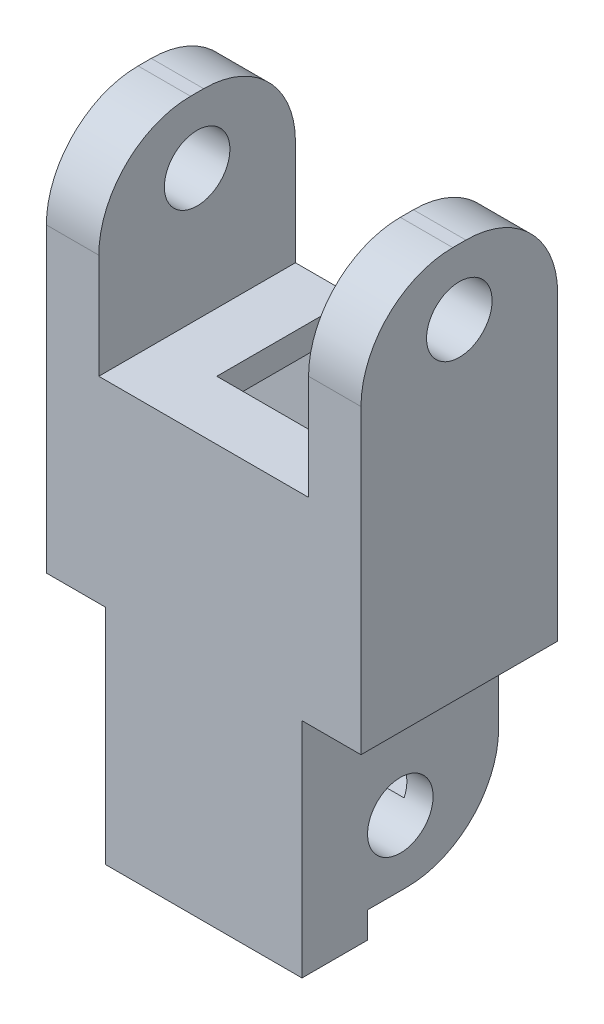
from build123d import *

# Parameters (mm, degrees)
SKETCH1_W           = 20
SKETCH1_H           = 11
SKETCH1_W_2         = 11
SKETCH1_H_2         = 13
BOSS_EXTRUDE1_DEPTH = 15
SKETCH2_R           = 2.5
CUT_EXTRUDE1_DEPTH  = 36
CUT_EXTRUDE2_DEPTH  = 36
CUT_EXTRUDE3_START  = 2
SKETCH1_3_W         = 20
SKETCH1_3_H         = 11
SKETCH1_3_W_2       = 11
SKETCH1_3_H_2       = 13
CUT_EXTRUDE3_DEPTH  = 11
FILLET4_R           = 7
BOSS_EXTRUDE2_REACH = 40.798
SKETCH5_W           = 5
SKETCH5_H           = 2


with BuildPart() as part:
    # Sketch1 → Boss-Extrude1 (new body)
    # profile 1 of 3: a face of its own
    with BuildSketch(Plane.XY):
        Polygon((-12, -15), (-12, 15), (-8, 15), (-8, 0), (8, 0), (8, 15), (12, 15), (12, -15), (7.5, -15), (7.5, -30), (-7.5, -30), (-7.5, -15), align=None)
        with Locations((0, -7.5)):
            Rectangle(SKETCH1_W, SKETCH1_H, mode=Mode.SUBTRACT)
    # profile 2 of 3: a face of its own
    with BuildSketch(Plane.XY):
        with Locations((0, -7.5)):
            Rectangle(SKETCH1_W, SKETCH1_H)
    # profile 3 of 3: a face of its own
    with BuildSketch(Plane.XY):
        with Locations((0, -19.5)):
            Rectangle(SKETCH1_W_2, SKETCH1_H_2)
    extrude(amount=BOSS_EXTRUDE1_DEPTH)

    # Sketch2 → Cut-Extrude1 (cut)
    with BuildSketch(Plane(origin=(12, 0, 0), x_dir=(0, 0, -1), z_dir=(1, 0, 0))):
        with Locations(Location((-7.5, 10, 0), (0, 0, 90))):
            Circle(SKETCH2_R)
        with Locations(Location((-7.5, -25, 0), (0, 0, 180))):
            Circle(SKETCH2_R)
    extrude(amount=-CUT_EXTRUDE1_DEPTH, mode=Mode.SUBTRACT)

    # Sketch3 → Cut-Extrude2 (cut)
    with BuildSketch(Plane(origin=(0, 0, 0), x_dir=(1, 0, 0), z_dir=(0, 1, 0))):
        Polygon((-1.25, 0), (1.25, 0), (1.25, -1.5), (3.5, -1.5), (3.5, -10.5), (-3.5, -10.5), (-3.5, -1.5), (-1.25, -1.5), align=None)
    extrude(amount=-CUT_EXTRUDE2_DEPTH, mode=Mode.SUBTRACT)

    # Sketch1<3> → Cut-Extrude3 (cut)
    with BuildSketch(Plane.XY.offset(CUT_EXTRUDE3_START)):
        with Locations((0, -7.5)):
            Rectangle(SKETCH1_3_W, SKETCH1_3_H)
        with Locations((0, -19.5)):
            Rectangle(SKETCH1_3_W_2, SKETCH1_3_H_2)
    extrude(amount=CUT_EXTRUDE3_DEPTH, mode=Mode.SUBTRACT)

    # Fillet4
    fillet4_edges = [part.edges().sort_by_distance(p)[0] for p in [
        (10, 15, 15),
        (10, 15, 0),
        (-10, 15, 15),
        (-10, 15, 0),
        (4.375, -30, 0),
        (-4.375, -30, 0),
    ]]
    fillet(fillet4_edges, radius=FILLET4_R)

    # Boss-Extrude2: up to this face of the body (flat: up to its plane)
    boss_extrude2_end = Plane(part.part.faces().sort_by_distance((-7.5, -21.9277031, 7.820372358))[0])
    # Sketch5 → Boss-Extrude2 (add, up to the picked face)
    with BuildSketch(Plane(origin=(7.5, 0, 0), x_dir=(0, 0, -1), z_dir=(1, 0, 0)), mode=Mode.PRIVATE) as boss_extrude2_sk1:
        with Locations((-12.5, -31)):
            Rectangle(SKETCH5_W, SKETCH5_H)
    boss_extrude2_tool1 = split(extrude(boss_extrude2_sk1.sketch, amount=-BOSS_EXTRUDE2_REACH, mode=Mode.PRIVATE), bisect_by=boss_extrude2_end, keep=Keep.BOTH, mode=Mode.PRIVATE)
    add(boss_extrude2_tool1.solids().sort_by(Axis((7.5, -31, 12.5), (-1, 0, 0)))[0])


solid = part.part
